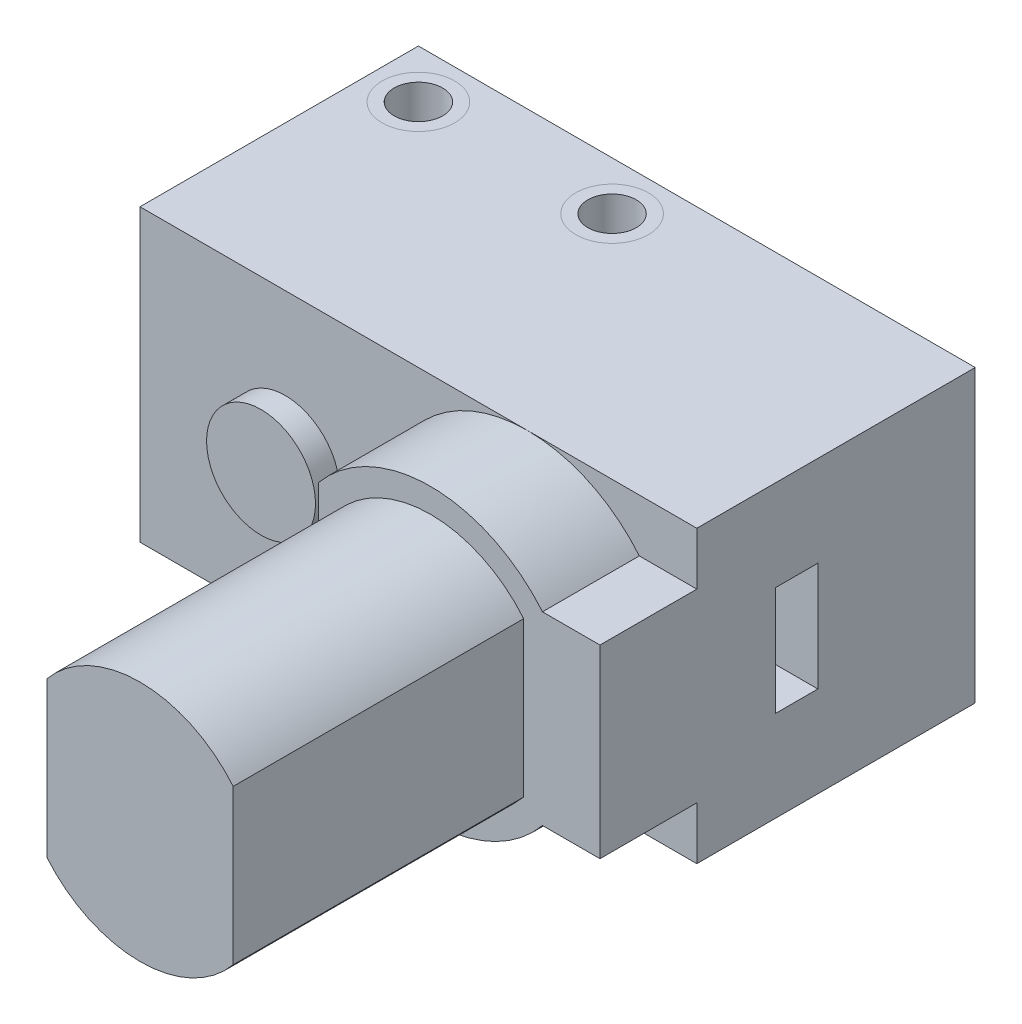
from build123d import *

# Parameters (mm, degrees)
SKETCH_1_W            = 46
SKETCH_1_H            = 23
EXTRUDE_1_DEPTH       = 24
EXTRUDE_2_DEPTH       = 8
EXTRUDE_3_DEPTH       = 24
SKETCH_4_R            = 4.5
SKETCH_4_R_2          = 2
EXTRUDE_4_DEPTH       = 2
SKETCH_6_W            = 3.5
SKETCH_6_H            = 9
CUT_EXTRUDE_1_DEPTH   = 5
SKETCH_7_R            = 2.7
EXTRUDE_5_DEPTH       = 2
EXTRUDE_6_DEPTH       = 7
SKETCH_9_R            = 1.25
CUT_EXTRUDE_2_DEPTH   = 5
SKETCH_10_R           = 3
CUT_EXTRUDE_3_DEPTH   = 8
CUT_EXTRUDE_START     = -16
SKETCH_10_2_R         = 3
CUT_EXTRUDE_4_DEPTH   = 8
SKETCH_11_R           = 2
CUT_EXTRUDE_5_DEPTH   = 8
SKETCH1_R             = 3
SKETCH1_R_2           = 2
BOSS_EXTRUDE1_DEPTH   = 8
BOSS_EXTRUDE1_2_DEPTH = 8
BOSS_EXTRUDE2_START   = -24
SKETCH1_2_R           = 3
SKETCH1_2_R_2         = 2
BOSS_EXTRUDE2_DEPTH   = 8
BOSS_EXTRUDE2_2_DEPTH = 8


with BuildPart() as part:
    # 草图1 → 凸台-拉伸1 (new body)
    with BuildSketch(Plane(origin=(0, 0, 0), x_dir=(1, 0, 0), z_dir=(0, 1, 0))):
        Rectangle(SKETCH_1_W, SKETCH_1_H)
    extrude(amount=EXTRUDE_1_DEPTH)

    # 草图2 → 凸台-拉伸2 (add)
    with BuildSketch(Plane.XY.offset(11.5)):
        with BuildLine():
            Line((-0.25, 19.644442426), (-0.25, 4.355557574))
            ThreePointArc((-0.25, 4.355557574), (9, 0), (18.25, 4.355557574))
            Line((18.25, 4.355557574), (23, 4.355557574))
            Line((23, 4.355557574), (23, 19.644442426))
            Line((23, 19.644442426), (18.25, 19.644442426))
            ThreePointArc((18.25, 19.644442426), (9, 24), (-0.25, 19.644442426))
        make_face()
    extrude(amount=EXTRUDE_2_DEPTH)

    # 草图3 → 凸台-拉伸3 (add)
    with BuildSketch(Plane.XY.offset(19.5)):
        with BuildLine():
            Line((1.3, 18.380438856), (1.3, 5.619561144))
            ThreePointArc((1.3, 5.619561144), (9, 2), (16.7, 5.619561144))
            Line((16.7, 5.619561144), (16.7, 18.380438856))
            ThreePointArc((16.7, 18.380438856), (9, 22), (1.3, 18.380438856))
        make_face()
    extrude(amount=EXTRUDE_3_DEPTH)

    # 草图4 → 凸台-拉伸4 (add)
    with BuildSketch(Plane.XY.offset(11.5)):
        with Locations(Location((-11, 12, 0), (0, 0, 180))):
            Circle(SKETCH_4_R)
        with Locations((-0.25, 12)):
            Circle(SKETCH_4_R_2)
    extrude(amount=EXTRUDE_4_DEPTH)

    # 草图6 → 切除-拉伸1 (cut)
    with BuildSketch(Plane(origin=(23, 0, 0), x_dir=(0, 0, -1), z_dir=(1, 0, 0))):
        with Locations((-3.25, 12)):
            Rectangle(SKETCH_6_W, SKETCH_6_H)
    extrude(amount=-CUT_EXTRUDE_1_DEPTH, mode=Mode.SUBTRACT)

    # 草图7 → 凸台-拉伸5 (add)
    with BuildSketch(Plane(origin=(0, 0, -11.5), x_dir=(-1, 0, 0), z_dir=(0, 0, -1))):
        with Locations(Location((11, 12, 0), (0, 0, 180))):
            Circle(SKETCH_7_R)
    extrude(amount=EXTRUDE_5_DEPTH)

    # 草图8 → 凸台-拉伸6 (add)
    with BuildSketch(Plane(origin=(0, 0, -13.5), x_dir=(-1, 0, 0), z_dir=(0, 0, -1))):
        with BuildLine():
            Line((9.25, 14.056088519), (9.25, 9.943911481))
            ThreePointArc((9.25, 9.943911481), (11, 9.3), (12.75, 9.943911481))
            Line((12.75, 9.943911481), (12.75, 14.056088519))
            ThreePointArc((12.75, 14.056088519), (11, 14.7), (9.25, 14.056088519))
        make_face()
    extrude(amount=EXTRUDE_6_DEPTH)

    # 草图9 → 切除-拉伸2 (cut)
    with BuildSketch(Plane(origin=(0, 0, -20.5), x_dir=(-1, 0, 0), z_dir=(0, 0, -1))):
        with Locations((11, 12)):
            Circle(SKETCH_9_R)
    extrude(amount=-CUT_EXTRUDE_2_DEPTH, mode=Mode.SUBTRACT)

    # 草图10 → 切除-拉伸3 (cut)
    with BuildSketch(Plane(origin=(0, 24, 0), x_dir=(1, 0, 0), z_dir=(0, 1, 0))):
        with Locations(Location((-19, 7.5, 0), (0, 0, 270))):
            Circle(SKETCH_10_R)
        with Locations(Location((-3, 7.5, 0), (0, 0, 270))):
            Circle(SKETCH_10_R)
    extrude(amount=-CUT_EXTRUDE_3_DEPTH, mode=Mode.SUBTRACT)

    # 草图10<2> → 切除-拉伸4 (cut)
    with BuildSketch(Plane(origin=(0, 24, 0), x_dir=(1, 0, 0), z_dir=(0, 1, 0)).offset(CUT_EXTRUDE_START)):
        with Locations(Location((-19, 7.5, 0), (0, 0, 270))):
            Circle(SKETCH_10_2_R)
        with Locations(Location((-3, 7.5, 0), (0, 0, 270))):
            Circle(SKETCH_10_2_R)
    extrude(amount=-CUT_EXTRUDE_4_DEPTH, mode=Mode.SUBTRACT)

    # 草图11 → 切除-拉伸5 (cut)
    with BuildSketch(Plane(origin=(0, 0, -11.5), x_dir=(-1, 0, 0), z_dir=(0, 0, -1))):
        with Locations((-13, 20)):
            Circle(SKETCH_11_R)
        with Locations((-13, 4)):
            Circle(SKETCH_11_R)
    extrude(amount=-CUT_EXTRUDE_5_DEPTH, mode=Mode.SUBTRACT)


with BuildPart() as body_2:
    # Sketch1 → Boss-Extrude1 (new body)
    with BuildSketch(Plane(origin=(0, 24, 0), x_dir=(1, 0, 0), z_dir=(0, 1, 0))):
        with Locations(Location((-3, 7.5, 0), (0, 0, 270))):
            Circle(SKETCH1_R)
        with Locations(Location((-3, 7.5, 0), (0, 0, 270))):
            Circle(SKETCH1_R_2, mode=Mode.SUBTRACT)
    extrude(amount=-BOSS_EXTRUDE1_DEPTH)


with BuildPart() as body_3:
    # Sketch1 → Boss-Extrude1 2 (new body)
    with BuildSketch(Plane(origin=(0, 24, 0), x_dir=(1, 0, 0), z_dir=(0, 1, 0))):
        with Locations(Location((-19, 7.5, 0), (0, 0, 270))):
            Circle(SKETCH1_R)
        with Locations(Location((-19, 7.5, 0), (0, 0, 270))):
            Circle(SKETCH1_R_2, mode=Mode.SUBTRACT)
    extrude(amount=-BOSS_EXTRUDE1_2_DEPTH)


with BuildPart() as body_4:
    # Sketch1<2> → Boss-Extrude2 (new body)
    with BuildSketch(Plane(origin=(0, 24, 0), x_dir=(1, 0, 0), z_dir=(0, 1, 0)).offset(BOSS_EXTRUDE2_START)):
        with Locations(Location((-3, 7.5, 0), (0, 0, 90))):
            Circle(SKETCH1_2_R)
        with Locations(Location((-3, 7.5, 0), (0, 0, 90))):
            Circle(SKETCH1_2_R_2, mode=Mode.SUBTRACT)
    extrude(amount=BOSS_EXTRUDE2_DEPTH)


with BuildPart() as body_5:
    # Sketch1<2> → Boss-Extrude2 2 (new body)
    with BuildSketch(Plane(origin=(0, 24, 0), x_dir=(1, 0, 0), z_dir=(0, 1, 0)).offset(BOSS_EXTRUDE2_START)):
        with Locations(Location((-19, 7.5, 0), (0, 0, 90))):
            Circle(SKETCH1_2_R)
        with Locations(Location((-19, 7.5, 0), (0, 0, 90))):
            Circle(SKETCH1_2_R_2, mode=Mode.SUBTRACT)
    extrude(amount=BOSS_EXTRUDE2_2_DEPTH)


solid = Compound([part.part, body_2.part, body_3.part, body_4.part, body_5.part])
